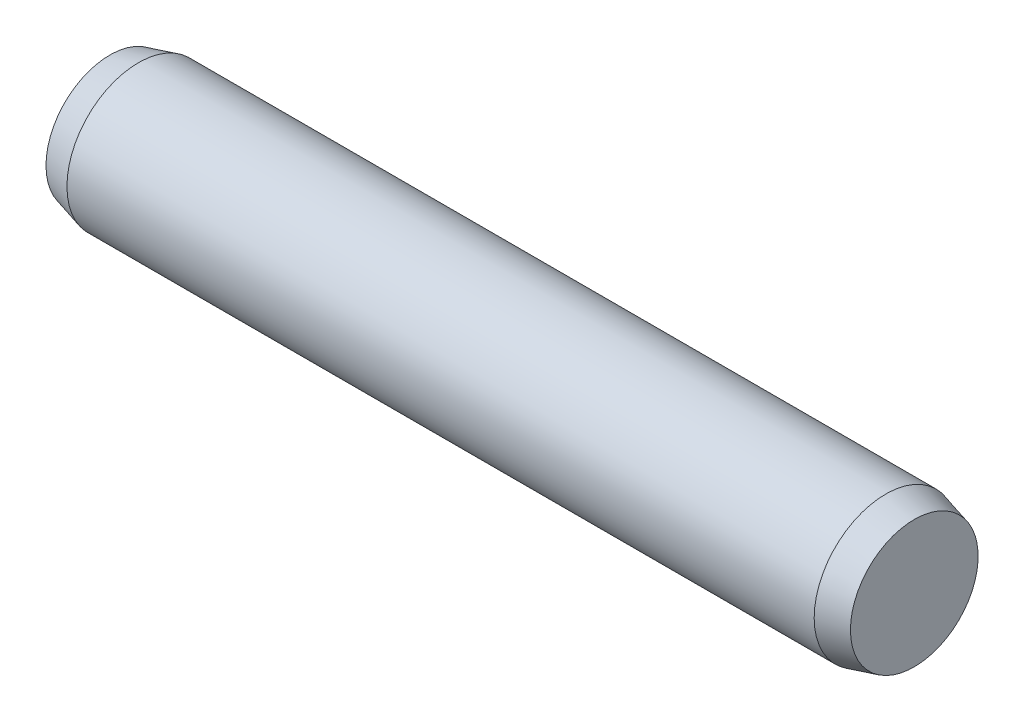
from build123d import *


with BuildPart() as part:
    # Sketch1 → Base-Revolve (revolve)
    with BuildSketch(Plane.XY, mode=Mode.PRIVATE) as base_revolve_sk:
        Polygon((0, 0), (45, 0), (45, 3.571281292), (43.4, 4), (1.6, 4), (0, 3.571281292), align=None)
    revolve(base_revolve_sk.sketch.rotate(Axis((-6.35, 0, 0), (1, 0, 0)), 90), axis=Axis((-6.35, 0, 0), (1, 0, 0)))


solid = part.part
